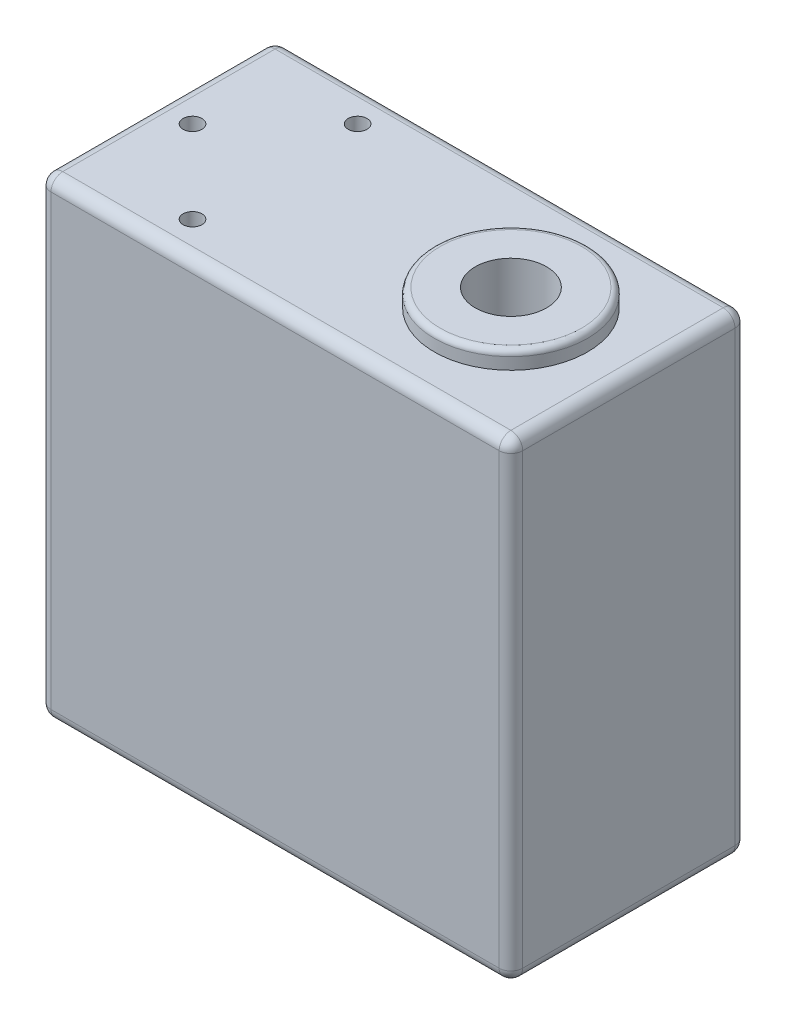
from build123d import *

# Parameters (mm, degrees)
SKETCH_1_W          = 40
SKETCH_1_H          = 40
EXTRUDE_1_DEPTH     = 10
FILLET_1_R          = 1
SKETCH_5_R          = 0.8
CUT_EXTRUDE_2_DEPTH = 5
SKETCH_6_R          = 0.8
CUT_EXTRUDE_3_DEPTH = 5
SKETCH_2_R          = 6.5
EXTRUDE_2_DEPTH     = 1.5
SKETCH_2_3_R        = 3.75
EXTRUDE_3_DEPTH     = 1.8
SKETCH_2_4_R        = 3
EXTRUDE_4_DEPTH     = 5.7
CUT_EXTRUDE_START   = 5.7
SKETCH_2_5_R        = 1.75
CUT_EXTRUDE_4_DEPTH = 7
FILLET_2_R          = 0.5
EXTRUDE_START       = 1.5
SKETCH_4_R          = 6.5
EXTRUDE_5_DEPTH     = 1.5
CUT_EXTRUDE_START_2 = 1.5
SKETCH_4_4_R        = 3.025
CUT_EXTRUDE_5_DEPTH = 7
FILLET_3_R          = 0.5


with BuildPart() as part:
    # 草图1 → 凸台-拉伸1 (new, symmetric)
    with BuildSketch(Plane.XY):
        Rectangle(SKETCH_1_W, SKETCH_1_H)
    extrude(amount=EXTRUDE_1_DEPTH, both=True)

    # 圆角1
    fillet_1_edges = [part.edges().sort_by_distance(p)[0] for p in [
        (-20, 0, 10),
        (0, -20, 10),
        (20, 0, 10),
        (0, -20, -10),
        (-20, 0, -10),
        (0, 20, -10),
        (20, 0, -10),
        (0, 20, 10),
        (20, -20, 0),
        (-20, -20, 0),
        (-20, 20, 0),
        (20, 20, 0),
    ]]
    fillet(fillet_1_edges, radius=FILLET_1_R)

    # 草图5 → 切除-拉伸2 (cut)
    with BuildSketch(Plane(origin=(0, -20, 0), x_dir=(-1, 0, 0), z_dir=(0, -1, 0))):
        with Locations(Location((17.5, -7.5, 0), (0, 0, 90))):
            Circle(SKETCH_5_R)
        with Locations(Location((2.5, -7.5, 0), (0, 0, 90))):
            Circle(SKETCH_5_R)
        with Locations(Location((2.5, 7.5, 0), (0, 0, 90))):
            Circle(SKETCH_5_R)
        with Locations(Location((17.5, 7.5, 0), (0, 0, 90))):
            Circle(SKETCH_5_R)
    extrude(amount=-CUT_EXTRUDE_2_DEPTH, mode=Mode.SUBTRACT)

    # 草图6 → 切除-拉伸3 (cut)
    with BuildSketch(Plane(origin=(0, 20, 0), x_dir=(1, 0, 0), z_dir=(0, 1, 0))):
        with Locations(Location((-10, 7, 0), (0, 0, 270))):
            Circle(SKETCH_6_R)
        with Locations(Location((-17, 0, 0), (0, 0, 270))):
            Circle(SKETCH_6_R)
        with Locations(Location((-10, -7, 0), (0, 0, 270))):
            Circle(SKETCH_6_R)
    extrude(amount=-CUT_EXTRUDE_3_DEPTH, mode=Mode.SUBTRACT)

    # 草图2 → 凸台-拉伸2 (add)
    with BuildSketch(Plane.XZ.offset(20)):
        with Locations(Location((10, 0, 0), (0, 0, 90))):
            Circle(SKETCH_2_R)
    extrude(amount=EXTRUDE_2_DEPTH)

    # 草图2<3> → 凸台-拉伸3 (add)
    with BuildSketch(Plane.XZ.offset(20)):
        with Locations(Location((10, 0, 0), (0, 0, 270))):
            Circle(SKETCH_2_3_R)
    extrude(amount=EXTRUDE_3_DEPTH)

    # 草图2<4> → 凸台-拉伸4 (add)
    with BuildSketch(Plane.XZ.offset(20)):
        with Locations(Location((10, 0, 0), (0, 0, 270))):
            Circle(SKETCH_2_4_R)
    extrude(amount=EXTRUDE_4_DEPTH)

    # 草图2<5> → 切除-拉伸4 (cut)
    with BuildSketch(Plane.XZ.offset(20).offset(CUT_EXTRUDE_START)):
        with Locations(Location((10, 0, 0), (0, 0, 270))):
            Circle(SKETCH_2_5_R)
    extrude(amount=-CUT_EXTRUDE_4_DEPTH, mode=Mode.SUBTRACT)

    # 圆角2
    fillet_2_edges = [part.edges().sort_by_distance(p)[0] for p in [
        (10, -21.5, -6.5),
    ]]
    fillet(fillet_2_edges, radius=FILLET_2_R)

    # 草图4 → 凸台-拉伸5 (add)
    with BuildSketch(Plane(origin=(0, 20, 0), x_dir=(1, 0, 0), z_dir=(0, 1, 0)).offset(EXTRUDE_START)):
        with Locations(Location((10, 0, 0), (0, 0, 270))):
            Circle(SKETCH_4_R)
    extrude(amount=-EXTRUDE_5_DEPTH)

    # 草图4<4> → 切除-拉伸5 (cut)
    with BuildSketch(Plane(origin=(0, 20, 0), x_dir=(1, 0, 0), z_dir=(0, 1, 0)).offset(CUT_EXTRUDE_START_2)):
        with Locations(Location((10, 0, 0), (0, 0, 270))):
            Circle(SKETCH_4_4_R)
    extrude(amount=-CUT_EXTRUDE_5_DEPTH, mode=Mode.SUBTRACT)

    # 圆角3
    fillet_3_edges = [part.edges().sort_by_distance(p)[0] for p in [
        (10, 21.5, -6.5),
    ]]
    fillet(fillet_3_edges, radius=FILLET_3_R)


solid = part.part
